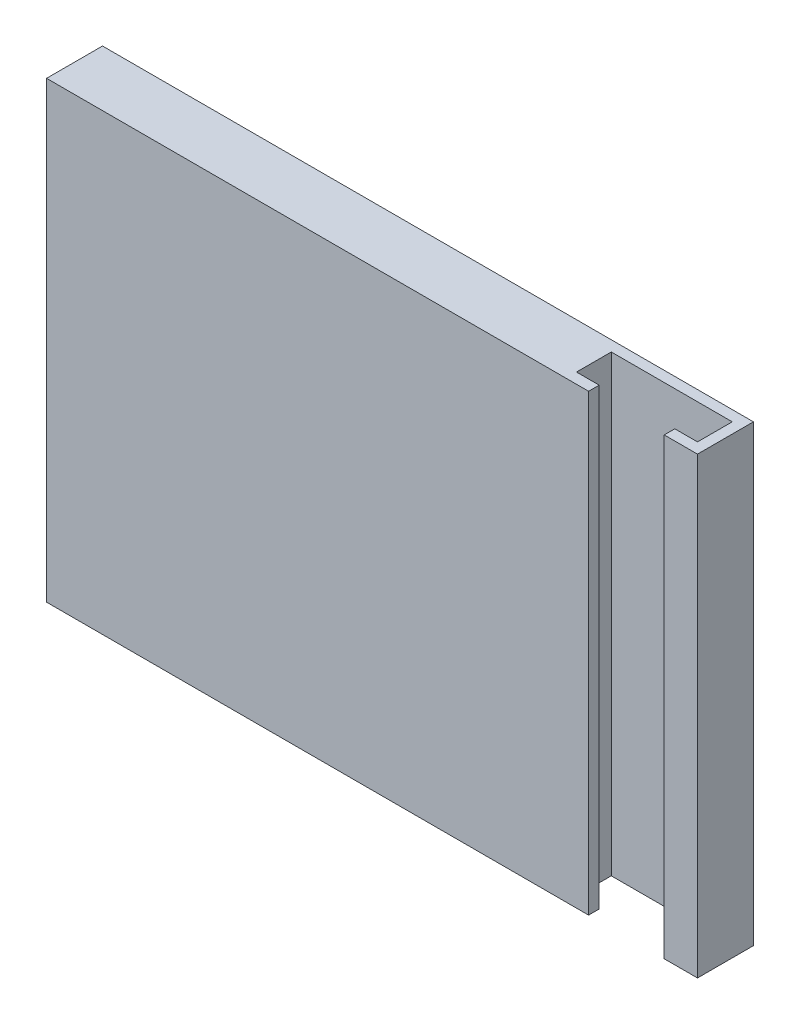
from build123d import *

# Parameters (mm, degrees)
BOSS_EXTRUDE1_DEPTH = 150
SKETCH2_W           = 336.422734183
SKETCH2_H           = 300
BOSS_EXTRUDE2_DEPTH = 37


with BuildPart() as part:
    # Sketch1 → Boss-Extrude1 (new, symmetric)
    with BuildSketch(Plane(origin=(0, 0, 0), x_dir=(1, 0, 0), z_dir=(0, 1, 0))):
        Polygon((131.503336753, 178.212463787), (146.503336753, 178.212463787), (146.503336753, 201.212463787), (66.503336753, 201.212463787), (66.503336753, 178.212463787), (81.503336753, 178.212463787), (81.503336753, 171.212463787), (59.503336753, 171.212463787), (59.503336753, 208.212463787), (153.503336753, 208.212463787), (153.503336753, 171.212463787), (131.503336753, 171.212463787), align=None)
    extrude(amount=BOSS_EXTRUDE1_DEPTH, both=True)

    # Sketch2 → Boss-Extrude2 (add)
    with BuildSketch(Plane.XY.offset(-171.212463787)):
        with Locations((-108.708030338, 0)):
            Rectangle(SKETCH2_W, SKETCH2_H)
    extrude(amount=-BOSS_EXTRUDE2_DEPTH)


solid = part.part
